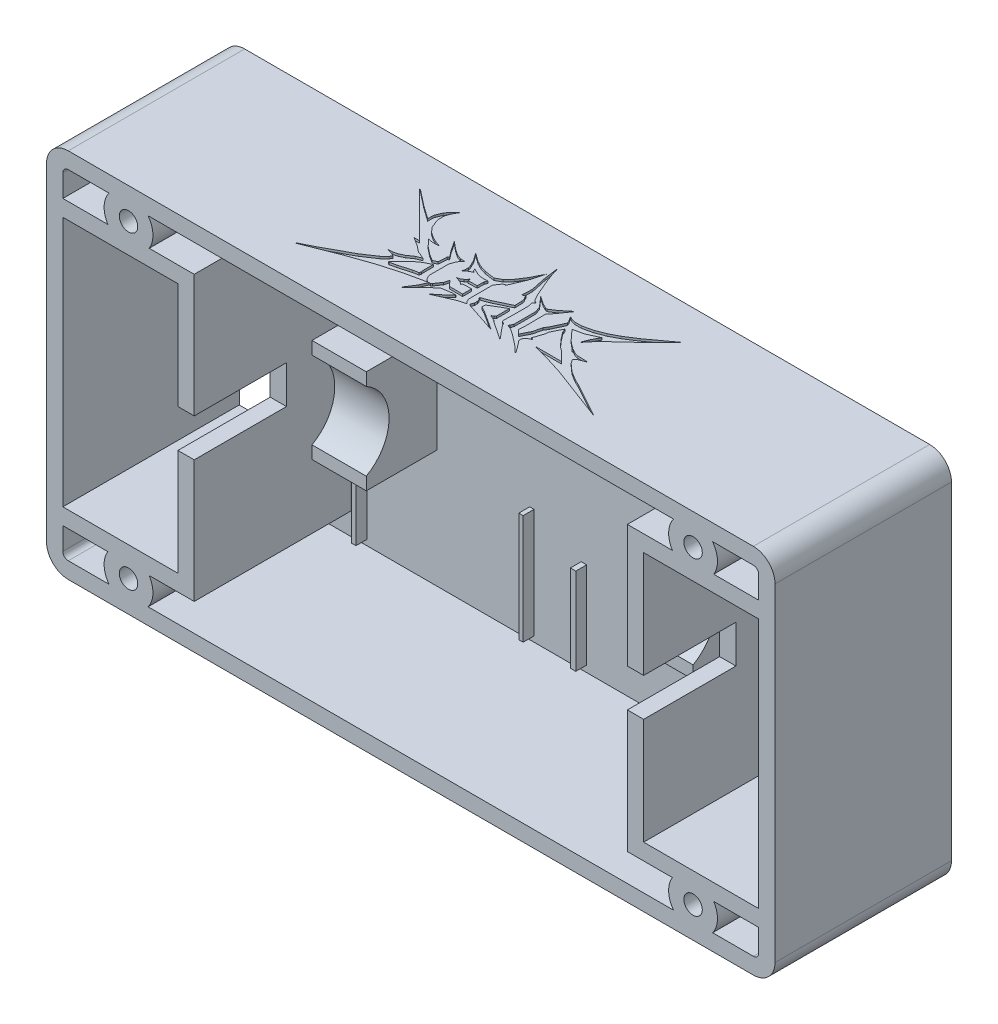
from build123d import *

# Parameters (mm, degrees)
BASE_FOOTPRINT_W                   = 134.2
BASE_FOOTPRINT_H                   = 68.4
UNBROKEN_FLOOR_DEPTH               = 2.6
SHELL_PROFILE_W                    = 134.2
SHELL_PROFILE_H                    = 68.4
SHELL_PROFILE_W_2                  = 128.2
SHELL_PROFILE_H_2                  = 62.4
THREE_MM_PERIMETER_DEPTH           = 32.5
OPEN_WHEEL_WELLS_START             = 36
WHEEL_WELL_PROFILE_W               = 21.2
WHEEL_WELL_PROFILE_H               = 46.2
OPEN_WHEEL_WELLS_DEPTH             = 38
WHEEL_GUARD_PROFILE_W              = 3
WHEEL_GUARD_PROFILE_H              = 46.2
INNER_WHEEL_GUARDS_DEPTH           = 32.5
WHEEL_RETURN_PROFILE_W             = 24.2
WHEEL_RETURN_PROFILE_H             = 3
WHEEL_RETURN_RIBS_DEPTH            = 32.5
OPEN_SHAFT_NOTCHES_START           = 32.5
SHAFT_DROP_IN_PROFILE_W            = 3.7
SHAFT_DROP_IN_PROFILE_H            = 7
OPEN_SHAFT_NOTCHES_DEPTH           = 17
LOWER_CRADLE_BLOCKS_PROFILE_W      = 10
LOWER_CRADLE_BLOCKS_PROFILE_H      = 19
LOWER_MOTOR_CRADLES_DEPTH          = 15.6
LOWER_CRADLE_SEATS_R8P2_START      = 36
LOWER_CRADLE_RADIUS_PROFILE_R      = 8.2
LOWER_CRADLE_SEATS_R8P2_DEPTH      = 72
BATTERY_SIDE_GUIDES_PROFILE_W      = 3
BATTERY_SIDE_GUIDES_PROFILE_H      = 21.2
BATTERY_SIDE_GUIDES_DEPTH          = 5.6
ELECTRONICS_LOCATORS_PROFILE_W     = 0.8
ELECTRONICS_LOCATORS_PROFILE_H     = 20.2
ELECTRONICS_LOCATORS_PROFILE_W_2   = 1
ELECTRONICS_LOCATORS_PROFILE_H_2   = 16
ELECTRONICS_LOCATORS_DEPTH         = 4.6
LID_SCREW_BOSS_PROFILE_R           = 4.5
REINFORCED_M3_BOSSES_DEPTH         = 32.5
M3_THROUGH_HOLES_START             = 35.5
M3_THROUGH_HOLES_PROFILE_R         = 1.7
M3_THROUGH_HOLES_DEPTH             = 36
M3_HEX_NUT_POCKETS_UNDERSIDE_START = 2.6
M3_HEX_NUT_POCKETS_UNDERSIDE_DEPTH = 2.7
OUTER_CORNERS_R4_R                 = 4
INNER_CORNERS_R1_R                 = 1
WHEEL_RETURN_ROOT_FILLETS_R1_R     = 1
VIPER_REAR_ENGRAVED_START          = 34.2
VIPER_REAR_ENGRAVED_DEPTH          = 0.4


with BuildPart() as part:
    # Base_Footprint → Unbroken_Floor (new body)
    with BuildSketch(Plane.XY):
        Rectangle(BASE_FOOTPRINT_W, BASE_FOOTPRINT_H)
    extrude(amount=UNBROKEN_FLOOR_DEPTH)

    # Shell_Profile → Three_mm_Perimeter (add)
    with BuildSketch(Plane.XY):
        Rectangle(SHELL_PROFILE_W, SHELL_PROFILE_H)
        Rectangle(SHELL_PROFILE_W_2, SHELL_PROFILE_H_2, mode=Mode.SUBTRACT)
    extrude(amount=THREE_MM_PERIMETER_DEPTH)

    # Wheel_Well_Profile → Open_Wheel_Wells (cut)
    with BuildSketch(Plane.XY.offset(OPEN_WHEEL_WELLS_START)):
        with Locations((53.5, 0)):
            Rectangle(WHEEL_WELL_PROFILE_W, WHEEL_WELL_PROFILE_H)
        with Locations((-53.5, 0)):
            Rectangle(WHEEL_WELL_PROFILE_W, WHEEL_WELL_PROFILE_H)
    extrude(amount=-OPEN_WHEEL_WELLS_DEPTH, mode=Mode.SUBTRACT)

    # Wheel_Guard_Profile → Inner_Wheel_Guards (add)
    with BuildSketch(Plane.XY):
        with Locations((41.4, 0)):
            Rectangle(WHEEL_GUARD_PROFILE_W, WHEEL_GUARD_PROFILE_H)
        with Locations((-41.4, 0)):
            Rectangle(WHEEL_GUARD_PROFILE_W, WHEEL_GUARD_PROFILE_H)
    extrude(amount=INNER_WHEEL_GUARDS_DEPTH)

    # Wheel_Return_Profile → Wheel_Return_Ribs (add)
    with BuildSketch(Plane.XY):
        with Locations((-52, -24.6)):
            Rectangle(WHEEL_RETURN_PROFILE_W, WHEEL_RETURN_PROFILE_H)
        with Locations((-52, 24.6)):
            Rectangle(WHEEL_RETURN_PROFILE_W, WHEEL_RETURN_PROFILE_H)
        with Locations((52, -24.6)):
            Rectangle(WHEEL_RETURN_PROFILE_W, WHEEL_RETURN_PROFILE_H)
        with Locations((52, 24.6)):
            Rectangle(WHEEL_RETURN_PROFILE_W, WHEEL_RETURN_PROFILE_H)
    extrude(amount=WHEEL_RETURN_RIBS_DEPTH)

    # Shaft_Drop_In_Profile → Open_Shaft_Notches (cut)
    with BuildSketch(Plane.XY.offset(OPEN_SHAFT_NOTCHES_START)):
        with Locations((-41.35, 0)):
            Rectangle(SHAFT_DROP_IN_PROFILE_W, SHAFT_DROP_IN_PROFILE_H)
        with Locations((41.35, 0)):
            Rectangle(SHAFT_DROP_IN_PROFILE_W, SHAFT_DROP_IN_PROFILE_H)
    extrude(amount=-OPEN_SHAFT_NOTCHES_DEPTH, mode=Mode.SUBTRACT)

    # Lower_Cradle_Blocks_Profile → Lower_Motor_Cradles (add)
    with BuildSketch(Plane.XY):
        with Locations((-30.1, 0)):
            Rectangle(LOWER_CRADLE_BLOCKS_PROFILE_W, LOWER_CRADLE_BLOCKS_PROFILE_H)
        with Locations((30.1, 0)):
            Rectangle(LOWER_CRADLE_BLOCKS_PROFILE_W, LOWER_CRADLE_BLOCKS_PROFILE_H)
    extrude(amount=LOWER_MOTOR_CRADLES_DEPTH)

    # Lower_Cradle_Radius_Profile → Lower_Cradle_Seats_R8p2 (cut)
    with BuildSketch(Plane(origin=(0, 0, 0), x_dir=(0, 0, -1), z_dir=(1, 0, 0)).offset(LOWER_CRADLE_SEATS_R8P2_START)):
        with Locations((-19.6, 0)):
            Circle(LOWER_CRADLE_RADIUS_PROFILE_R)
    extrude(amount=-LOWER_CRADLE_SEATS_R8P2_DEPTH, mode=Mode.SUBTRACT)

    # Battery_Side_Guides_Profile → Battery_Side_Guides (add)
    with BuildSketch(Plane.XY):
        with Locations((-30, 20.6)):
            Rectangle(BATTERY_SIDE_GUIDES_PROFILE_W, BATTERY_SIDE_GUIDES_PROFILE_H)
        with Locations((30, 20.6)):
            Rectangle(BATTERY_SIDE_GUIDES_PROFILE_W, BATTERY_SIDE_GUIDES_PROFILE_H)
    extrude(amount=BATTERY_SIDE_GUIDES_DEPTH)

    # Electronics_Locators_Profile → Electronics_Locators (add)
    with BuildSketch(Plane.XY):
        with Locations((-38.4, -20.1)):
            Rectangle(ELECTRONICS_LOCATORS_PROFILE_W, ELECTRONICS_LOCATORS_PROFILE_H)
        with Locations((-7.6, -20.1)):
            Rectangle(ELECTRONICS_LOCATORS_PROFILE_W, ELECTRONICS_LOCATORS_PROFILE_H)
        with Locations((2, -22)):
            Rectangle(ELECTRONICS_LOCATORS_PROFILE_W_2, ELECTRONICS_LOCATORS_PROFILE_H_2)
        with Locations((34, -22)):
            Rectangle(ELECTRONICS_LOCATORS_PROFILE_W_2, ELECTRONICS_LOCATORS_PROFILE_H_2)
    extrude(amount=ELECTRONICS_LOCATORS_DEPTH)

    # Lid_Screw_Boss_Profile → Reinforced_M3_Bosses (add)
    with BuildSketch(Plane.XY):
        with Locations((-52, -28.5)):
            Circle(LID_SCREW_BOSS_PROFILE_R)
        with Locations((-52, 28.5)):
            Circle(LID_SCREW_BOSS_PROFILE_R)
        with Locations((52, -28.5)):
            Circle(LID_SCREW_BOSS_PROFILE_R)
        with Locations((52, 28.5)):
            Circle(LID_SCREW_BOSS_PROFILE_R)
    extrude(amount=REINFORCED_M3_BOSSES_DEPTH)

    # M3_Through_Holes_Profile → M3_Through_Holes (cut)
    with BuildSketch(Plane.XY.offset(M3_THROUGH_HOLES_START)):
        with Locations(Location((-52, -28.5, 0), (0, 0, 180))):
            Circle(M3_THROUGH_HOLES_PROFILE_R)
        with Locations(Location((-52, 28.5, 0), (0, 0, 180))):
            Circle(M3_THROUGH_HOLES_PROFILE_R)
        with Locations(Location((52, -28.5, 0), (0, 0, 180))):
            Circle(M3_THROUGH_HOLES_PROFILE_R)
        with Locations(Location((52, 28.5, 0), (0, 0, 180))):
            Circle(M3_THROUGH_HOLES_PROFILE_R)
    extrude(amount=-M3_THROUGH_HOLES_DEPTH, mode=Mode.SUBTRACT)

    # Captive_Nut_Pockets_Profile → M3_Hex_Nut_Pockets_Underside (cut)
    with BuildSketch(Plane.XY.offset(M3_HEX_NUT_POCKETS_UNDERSIDE_START)):
        Polygon((-48.709103466, -28.5), (-50.354551733, -25.65), (-53.645448267, -25.65), (-55.290896534, -28.5), (-53.645448267, -31.35), (-50.354551733, -31.35), align=None)
        Polygon((-48.709103466, 28.5), (-50.354551733, 31.35), (-53.645448267, 31.35), (-55.290896534, 28.5), (-53.645448267, 25.65), (-50.354551733, 25.65), align=None)
        Polygon((55.290896534, -28.5), (53.645448267, -25.65), (50.354551733, -25.65), (48.709103466, -28.5), (50.354551733, -31.35), (53.645448267, -31.35), align=None)
        Polygon((55.290896534, 28.5), (53.645448267, 31.35), (50.354551733, 31.35), (48.709103466, 28.5), (50.354551733, 25.65), (53.645448267, 25.65), align=None)
    extrude(amount=-M3_HEX_NUT_POCKETS_UNDERSIDE_DEPTH, mode=Mode.SUBTRACT)

    # Outer_Corners_R4
    outer_corners_r4_edges = [part.edges().sort_by_distance(p)[0] for p in [
        (-67.1, 34.2, 16.25),
        (67.1, 34.2, 16.25),
        (67.1, -34.2, 16.25),
        (-67.1, -34.2, 16.25),
    ]]
    fillet(outer_corners_r4_edges, radius=OUTER_CORNERS_R4_R)

    # Inner_Corners_R1
    inner_corners_r1_edges = [part.edges().sort_by_distance(p)[0] for p in [
        (-64.1, -31.2, 17.55),
        (64.1, -31.2, 17.55),
        (64.1, 31.2, 17.55),
        (-64.1, 31.2, 17.55),
    ]]
    fillet(inner_corners_r1_edges, radius=INNER_CORNERS_R1_R)

    # Wheel_Return_Root_Fillets_R1
    wheel_return_root_fillets_r1_edges = [part.edges().sort_by_distance(p)[0] for p in [
        (-39.9, 0, 2.6),
        (39.9, 0, 2.6),
        (-44.046713369, 26.1, 2.6),
        (44.046713369, -26.1, 2.6),
        (59.953286631, 26.1, 2.6),
        (-59.953286631, -26.1, 2.6),
        (-59.953286631, 26.1, 2.6),
        (59.953286631, -26.1, 2.6),
        (44.046713369, 26.1, 2.6),
        (-44.046713369, -26.1, 2.6),
    ]]
    fillet(wheel_return_root_fillets_r1_edges, radius=WHEEL_RETURN_ROOT_FILLETS_R1_R)

    # VIPER_Wordmark_Native_Profile → VIPER_Rear_Engraved (cut)
    # profile 1 of 4: a face of its own
    with BuildSketch(Plane(origin=(0, 0, 0), x_dir=(1, 0, 0), z_dir=(0, 1, 0)).offset(VIPER_REAR_ENGRAVED_START)):
        Polygon((27.5, -26.323476703), (17.406810036, -22.538530466), (13.897849462, -21.434587814), (11.335125448, -20.764336918), (11.295698925, -20.685483871), (15.948028674, -20.685483871), (14.213261649, -18.950716846), (13.543010753, -18.477598566), (12.32078853, -17.137096774), (11.374551971, -15.875448029), (11.098566308, -15.165770609), (10.073476703, -17.215949821), (10.073476703, -17.649641577), (9.5609319, -19.226702509), (9.363799283, -19.581541219), (9.797491039, -19.818100358), (9.797491039, -19.896953405), (9.521505376, -19.936379928), (9.08781362, -20.212365591), (8.772401434, -20.527777778), (8.614695341, -20.843189964), (8.654121864, -21.237455197), (9.758064516, -22.656810036), (10.310035842, -23.445340502), (10.270609319, -23.524193548), (9.127240143, -22.459677419), (7.155913978, -20.922043011), (5.97311828, -20.133512545), (5.224014337, -19.857526882), (5.421146953, -19.620967742), (5.61827957, -19.068996416), (5.61827957, -15.244623656), (5.539426523, -14.850358423), (5.224014337, -14.022401434), (3.686379928, -12.248207885), (5.02688172, -13.155017921), (5.97311828, -13.628136201), (6.249103943, -13.667562724), (7.471326165, -12.879032258), (9.32437276, -11.341397849), (7.668458781, -13.706989247), (6.919354839, -14.57437276), (6.958781362, -18.122759857), (6.879928315, -19.581541219), (7.629032258, -20.251792115), (8.456989247, -18.595878136), (8.85125448, -17.018817204), (9.284946237, -16.309139785), (10.349462366, -14.022401434), (10.191756272, -13.588709677), (9.639784946, -12.721326165), (10.231182796, -12.997311828), (10.901433692, -13.155017921), (12.123655914, -13.155017921), (13.976702509, -12.721326165), (15.711469534, -12.051075269), (17.367383513, -11.183691756), (19.535842294, -9.803763441), (24.26702509, -6.334229391), (20.048387097, -10.474014337), (17.406810036, -12.918458781), (15.593189964, -14.732078853), (14.686379928, -15.836021505), (14.646953405, -15.717741935), (15.080645161, -14.613799283), (15.869175627, -13.155017921), (13.621863799, -14.180107527), (11.768817204, -14.57437276), (13.503584229, -16.466845878), (14.410394265, -17.215949821), (14.725806452, -17.373655914), (15.001792115, -17.767921147), (15.120071685, -17.6890681), (15.908602151, -18.122759857), (16.5, -18.28046595), (18.471326165, -18.359318996), (17.209677419, -18.871863799), (16.815412186, -19.147849462), (16.657706093, -19.384408602), (17.130824373, -20.094086022), (18.550179211, -21.355734767), (20.08781362, -22.301971326), (21.310035842, -22.893369176), align=None)
    # profile 2 of 4: a face of its own
    with BuildSketch(Plane(origin=(0, 0, 0), x_dir=(1, 0, 0), z_dir=(0, 1, 0)).offset(VIPER_REAR_ENGRAVED_START)):
        Polygon((-27.421146953, -26.284050179), (-27.5, -26.284050179), (-27.460573477, -26.205197133), (-25.016129032, -24.98297491), (-19.96953405, -22.22311828), (-17.603942652, -20.646057348), (-16.697132616, -19.778673835), (-16.421146953, -19.344982079), (-16.894265233, -19.108422939), (-18.077060932, -18.793010753), (-17.130824373, -18.753584229), (-16.302867384, -18.556451613), (-15.396057348, -18.122759857), (-14.252688172, -17.334229391), (-13.306451613, -16.979390681), (-14.331541219, -16.506272401), (-14.607526882, -16.466845878), (-15.790322581, -15.520609319), (-17.406810036, -14.495519713), (-16.421146953, -14.495519713), (-24.621863799, -6.255376344), (-24.621863799, -6.176523297), (-24.464157706, -6.255376344), (-21.546594982, -8.542114695), (-19.141577061, -10.237455197), (-19.181003584, -9.409498208), (-19.102150538, -8.975806452), (-18.629032258, -7.871863799), (-18.116487455, -7.16218638), (-17.091397849, -6.176523297), (-17.761648746, -7.359318996), (-18.037634409, -8.187275986), (-18.077060932, -9.251792115), (-17.958781362, -9.803763441), (-17.367383513, -11.22311828), (-16.61827957, -12.051075269), (-15.711469534, -12.681899642), (-14.844086022, -13.115591398), (-13.700716846, -13.509856631), (-14.922939068, -13.549283154), (-15.829749104, -13.391577061), (-14.686379928, -14.613799283), (-13.306451613, -15.717741935), (-12.084229391, -16.466845878), (-11.335125448, -16.112007168), (-11.256272401, -14.613799283), (-11.216845878, -14.45609319), (-10.940860215, -14.416666667), (-11.808243728, -13.312724014), (-13.109318996, -11.380824373), (-11.768817204, -12.484767025), (-10.664874552, -13.233870968), (-9.797491039, -13.588709677), (-8.85125448, -13.628136201), (-9.363799283, -14.10125448), (-9.639784946, -14.495519713), (-9.994623656, -15.520609319), (-9.994623656, -19.147849462), (-9.639784946, -19.896953405), (-9.048387097, -20.330645161), (-12.872759857, -21.158602151), (-16.85483871, -22.301971326), (-21.231182796, -23.839605735), align=None)
        Polygon((-15.908602151, -20.685483871), (-15.790322581, -20.724910394), (-14.568100358, -20.448924731), (-12.399641577, -19.818100358), (-11.374551971, -19.620967742), (-11.256272401, -19.305555556), (-11.335125448, -18.911290323), (-11.335125448, -17.018817204), (-12.636200717, -17.649641577), (-13.818996416, -18.51702509), align=None, mode=Mode.SUBTRACT)
    # profile 3 of 4: a face of its own
    with BuildSketch(Plane(origin=(0, 0, 0), x_dir=(1, 0, 0), z_dir=(0, 1, 0)).offset(VIPER_REAR_ENGRAVED_START)):
        Polygon((-10.586021505, -23.563620072), (-10.625448029, -23.484767025), (-9.44265233, -21.63172043), (-8.85125448, -20.291218638), (-8.575268817, -20.291218638), (-8.378136201, -20.133512545), (-7.550179211, -18.911290323), (-7.274193548, -18.004480287), (-6.367383513, -19.029569892), (-3.922939068, -19.029569892), (-3.922939068, -17.373655914), (-5.578853047, -17.413082437), (-5.61827957, -17.767921147), (-5.775985663, -17.531362007), (-6.130824373, -17.294802867), (-7.155913978, -16.979390681), (-6.603942652, -16.821684588), (-6.130824373, -16.545698925), (-5.61827957, -15.993727599), (-5.539426523, -16.387992832), (-3.922939068, -16.348566308), (-3.883512545, -15.086917563), (-3.686379928, -14.613799283), (-4.632616487, -14.653225806), (-5.5, -14.534946237), (-6.801075269, -13.904121864), (-6.603942652, -14.377240143), (-6.367383513, -14.45609319), (-6.367383513, -14.534946237), (-6.958781362, -14.8109319), (-7.707885305, -15.402329749), (-7.589605735, -14.968637993), (-7.589605735, -14.298387097), (-7.786738351, -13.628136201), (-8.338709677, -12.563620072), (-9.245519713, -11.301971326), (-7.707885305, -12.405913978), (-6.682795699, -12.918458781), (-5.460573477, -13.312724014), (-3.607526882, -13.588709677), (-2.543010753, -12.997311828), (-1.55734767, -11.972222222), (-0.413978495, -10.237455197), (0.650537634, -8.068996416), (-0.098566308, -10.710573477), (-1.360215054, -13.706989247), (-1.517921147, -13.588709677), (-1.754480287, -13.706989247), (-2.109318996, -14.10125448), (-2.582437276, -14.889784946), (-2.582437276, -19.226702509), (-2.345878136, -19.778673835), (-1.951612903, -20.172939068), (-3.410394265, -20.567204301), (-7.195340502, -22.22311828), (-5.97311828, -21.27688172), (-4.396057348, -19.857526882), (-4.396057348, -19.778673835), (-5.14516129, -19.818100358), (-6.879928315, -20.094086022), (-8.73297491, -21.671146953), align=None)
    # profile 4 of 4: a face of its own
    with BuildSketch(Plane(origin=(0, 0, 0), x_dir=(1, 0, 0), z_dir=(0, 1, 0)).offset(VIPER_REAR_ENGRAVED_START)):
        Polygon((6.840501792, -22.893369176), (3.252688172, -20.488351254), (3.134408602, -20.330645161), (2.069892473, -19.857526882), (2.503584229, -19.660394265), (2.700716846, -19.423835125), (2.700716846, -17.018817204), (-0.059139785, -18.674731183), (-0.098566308, -19.305555556), (0.887096774, -19.818100358), (4.356630824, -22.065412186), (-1.399641577, -20.172939068), (-1.636200717, -20.015232975), (-1.399641577, -19.344982079), (-1.399641577, -18.793010753), (-1.55734767, -18.359318996), (-1.79390681, -18.083333333), (-1.754480287, -18.004480287), (-0.295698925, -17.452508961), (2.700716846, -16.033154122), (2.661290323, -14.653225806), (2.503584229, -14.061827957), (2.227598566, -13.706989247), (2.188172043, -13.431003584), (1.67562724, -13.746415771), (1.754480287, -11.853942652), (1.123655914, -8.896953405), (0.808243728, -6.413082437), (0.887096774, -6.452508961), (1.044802867, -7.16218638), (1.715053763, -9.015232975), (3.055555556, -12.129928315), (3.686379928, -13.312724014), (4.080645161, -13.628136201), (4.277777778, -13.667562724), (3.883512545, -14.10125448), (4.080645161, -15.008064516), (4.041218638, -19.620967742), (4.238351254, -19.818100358), (4.474910394, -19.896953405), (5.02688172, -20.724910394), align=None)
    extrude(amount=-VIPER_REAR_ENGRAVED_DEPTH, mode=Mode.SUBTRACT)


solid = part.part
